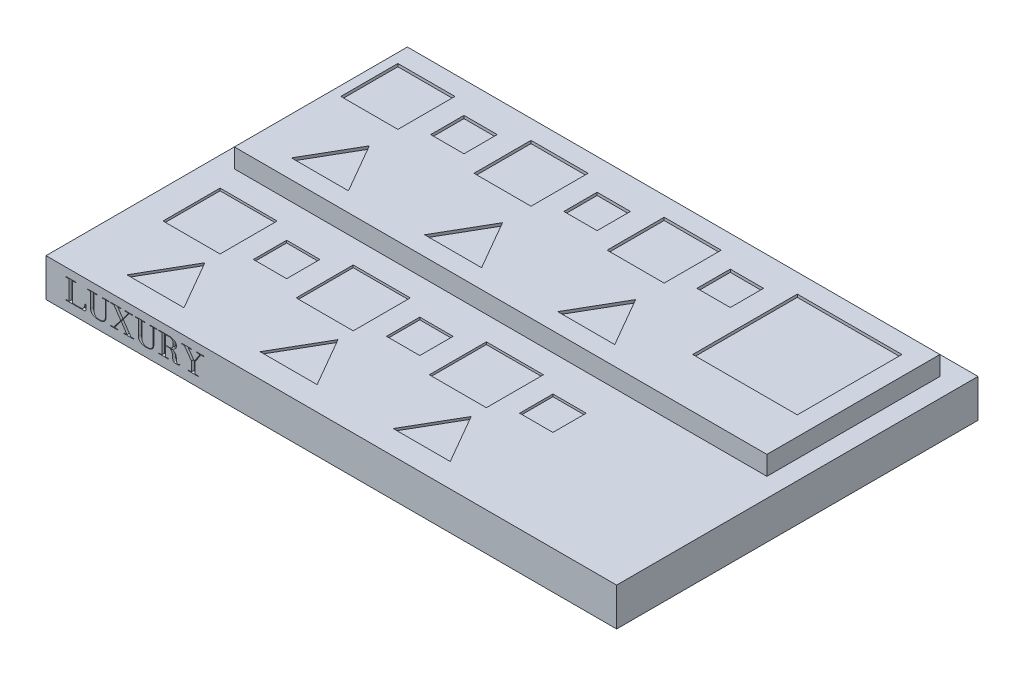
from build123d import *

# Parameters (mm, degrees)
SKETCH1_W           = 600
SKETCH1_H           = 380
BOSS_EXTRUDE3_DEPTH = 40
CUT_EXTRUDE1_DEPTH  = 3
SKETCH5_R           = 25
SKETCH5_W           = 60
SKETCH5_H           = 60
CUT_EXTRUDE2_DEPTH  = 3
SKETCH6_W           = 560
SKETCH6_H           = 181.961524227
BOSS_EXTRUDE4_DEPTH = 20
SKETCH8_W           = 60
SKETCH8_H           = 60
SKETCH8_W_2         = 35
SKETCH8_H_2         = 35
SKETCH8_W_3         = 110
SKETCH8_H_3         = 110
CUT_EXTRUDE12_DEPTH = 3
SKETCH8_7_W         = 60
SKETCH8_7_H         = 60
SKETCH8_7_W_2       = 35
SKETCH8_7_H_2       = 35
CUT_EXTRUDE13_DEPTH = 22.5


with BuildPart() as part:
    # Sketch1 → Boss-Extrude3 (new body)
    with BuildSketch(Plane(origin=(0, 0, 0), x_dir=(1, 0, 0), z_dir=(0, 1, 0))):
        Rectangle(SKETCH1_W, SKETCH1_H)
    extrude(amount=-BOSS_EXTRUDE3_DEPTH)

    # Sketch2 → Cut-Extrude1 (cut)
    # profile 1 of 6: a face of its own
    with BuildSketch(Plane.XY.offset(190)):
        with BuildLine():
            add(Edge.make_bspline(
                [(-258.895558648, -23.936742187), (-258.997269322, -24.328875191), (-259.191725751, -25.078578054), (-259.466634354, -25.9856335), (-259.720538833, -26.645863024), (-259.929426881, -27.099135568), (-260.174917938, -27.515424324), (-260.443382228, -27.901972822), (-260.751834109, -28.246508697), (-261.09308975, -28.555337155), (-261.480890253, -28.810047091), (-261.903130637, -29.031704786), (-262.375316644, -29.200067568), (-262.902279881, -29.313090604), (-263.482805759, -29.39096417), (-263.890288122, -29.397666543), (-264.102662001, -29.401159722)],
                knots=[0, 0, 0, 0, 2.029248764, 3.879636745, 4.742725827, 5.570893073, 6.376049095, 7.160594553, 7.924093065, 8.687591576, 9.458842347, 10.241402153, 11.071592956, 11.960350658, 12.936964441, 14, 14, 14, 14], degree=3))
            Line((-264.102662001, -29.401159722), (-271.901620931, -29.401159722))
            Line((-271.901620931, -29.401159722), (-271.901620931, -9.040590278))
            Line((-271.901620931, -9.040590278), (-268.289865506, -9.040590278))
            Line((-268.289865506, -9.040590278), (-268.289865506, -8.44175))
            Line((-268.289865506, -8.44175), (-278.85846072, -8.44175))
            Line((-278.85846072, -8.44175), (-278.85846072, -9.040590278))
            Line((-278.85846072, -9.040590278), (-275.588231391, -9.040590278))
            Line((-275.588231391, -9.040590278), (-275.588231391, -29.401159722))
            Line((-275.588231391, -29.401159722), (-278.85846072, -29.401159722))
            Line((-278.85846072, -29.401159722), (-278.85846072, -30))
            Line((-278.85846072, -30), (-259.274512261, -30))
            add(Edge.make_bspline(
                [(-259.274512261, -30), (-259.188418744, -29.996502143), (-259.025444389, -29.989880726), (-258.798907857, -29.938643412), (-258.601632119, -29.855451762), (-258.447477975, -29.724175967), (-258.318622939, -29.566398032), (-258.237314891, -29.368031161), (-258.184675279, -29.138805425), (-258.178414328, -28.974213972), (-258.175078939, -28.886531359)],
                knots=[0, 0, 0, 0, 1.151657564, 2.180078777, 3.096125633, 3.986580873, 4.863960426, 5.799091186, 6.827512399, 8, 8, 8, 8], degree=3))
            Line((-258.175078939, -28.886531359), (-258.175078939, -24.034989421))
            add(Edge.make_bspline(
                [(-258.175078939, -24.034989421), (-258.177842651, -23.920401065), (-258.182623748, -23.722168357), (-258.229247011, -23.47393322), (-258.325636232, -23.292791061), (-258.432069631, -23.268929615), (-258.479177517, -23.258368435)],
                knots=[0, 0, 0, 0, 1.51012458, 2.612447694, 3.385863296, 4, 4, 4, 4], degree=3))
            add(Edge.make_bspline(
                [(-258.479177517, -23.258368435), (-258.523973094, -23.26803895), (-258.624594211, -23.28976114), (-258.731891004, -23.446992928), (-258.825800689, -23.660647313), (-258.870391303, -23.837132407), (-258.895558648, -23.936742187)],
                knots=[0, 0, 0, 0, 0.632397312, 1.420509106, 2.544112054, 4, 4, 4, 4], degree=3))
        make_face()
    # profile 2 of 6: a face of its own
    with BuildSketch(Plane.XY.offset(190)):
        with BuildLine():
            Line((-246.179559625, -8.44175), (-256.406628743, -8.44175))
            Line((-256.406628743, -8.44175), (-256.406628743, -9.040590278))
            Line((-256.406628743, -9.040590278), (-253.136399414, -9.040590278))
            Line((-253.136399414, -9.040590278), (-253.136399414, -24.853716363))
            add(Edge.make_bspline(
                [(-253.136399414, -24.853716363), (-253.129091047, -25.127464043), (-253.114938624, -25.657567788), (-252.958944178, -26.414012673), (-252.724115678, -27.107572296), (-252.376163673, -27.72398883), (-251.948943331, -28.269132845), (-251.474815745, -28.768124964), (-250.935649017, -29.203146874), (-250.346164703, -29.587332901), (-249.708489747, -29.911400279), (-249.036208214, -30.189605845), (-248.327052165, -30.414199964), (-247.587754635, -30.583579351), (-246.832406052, -30.707637561), (-246.076557359, -30.794545846), (-245.325933191, -30.854918852), (-244.827605857, -30.861990832), (-244.579533257, -30.865511339)],
                knots=[0, 0, 0, 0, 1.117332706, 2.163679528, 3.143466512, 4.099407962, 5.040333412, 5.969023148, 6.90683423, 7.865110614, 8.840116802, 9.826187186, 10.836176266, 11.876779503, 12.923669842, 13.963394149, 14.986156138, 16, 16, 16, 16], degree=3))
            add(Edge.make_bspline(
                [(-244.579533257, -30.865511339), (-244.286204943, -30.86127932), (-243.715819197, -30.853050033), (-242.886020591, -30.782033346), (-242.105950809, -30.6661183), (-241.376490544, -30.504556763), (-240.695059396, -30.293231248), (-240.065763069, -30.032630555), (-239.484028494, -29.726540631), (-238.953680878, -29.37655212), (-238.47592973, -28.978014296), (-238.063995768, -28.526866401), (-237.711135186, -28.03053949), (-237.43257444, -27.483314439), (-237.209864747, -26.892060914), (-237.052638716, -26.25466638), (-236.957991457, -25.569230774), (-236.945888478, -25.097308668), (-236.939641276, -24.853716363)],
                knots=[0, 0, 0, 0, 1.273533264, 2.476423814, 3.613205589, 4.695854947, 5.717487145, 6.707201097, 7.649273476, 8.567684301, 9.461602455, 10.343487192, 11.213356554, 12.09773367, 13.00205606, 13.951353435, 14.942548926, 16, 16, 16, 16], degree=3))
            Line((-236.939641276, -24.853716363), (-236.939641276, -9.040590278))
            Line((-236.939641276, -9.040590278), (-233.669411947, -9.040590278))
            Line((-233.669411947, -9.040590278), (-233.669411947, -8.44175))
            Line((-233.669411947, -8.44175), (-240.818067763, -8.44175))
            Line((-240.818067763, -8.44175), (-240.818067763, -9.040590278))
            Line((-240.818067763, -9.040590278), (-237.547838433, -9.040590278))
            Line((-237.547838433, -9.040590278), (-237.547838433, -24.853716363))
            add(Edge.make_bspline(
                [(-237.547838433, -24.853716363), (-237.55260588, -25.063025506), (-237.56193744, -25.472716696), (-237.653384597, -26.070468151), (-237.801594332, -26.636272823), (-238.014995859, -27.16422664), (-238.27113127, -27.65795862), (-238.576931246, -28.110490803), (-238.931676118, -28.5202205), (-239.32793145, -28.889910044), (-239.768686468, -29.212852709), (-240.240601997, -29.501694813), (-240.754972662, -29.736694882), (-241.29617451, -29.940588118), (-241.867478876, -30.091376299), (-242.459533566, -30.205850096), (-243.074733858, -30.271087827), (-243.492428818, -30.280567881), (-243.704665039, -30.28538482)],
                knots=[0, 0, 0, 0, 1.08716204, 2.127956295, 3.13454735, 4.120366762, 5.081077667, 6.020736822, 6.951722068, 7.89225469, 8.830829615, 9.787154316, 10.76252305, 11.765223536, 12.789572198, 13.829166544, 14.896971397, 16, 16, 16, 16], degree=3))
            add(Edge.make_bspline(
                [(-243.704665039, -30.28538482), (-243.921616383, -30.280836566), (-244.344064065, -30.271980206), (-244.958637606, -30.204998245), (-245.538599215, -30.099886928), (-246.082722005, -29.943542197), (-246.595668615, -29.749739912), (-247.070561413, -29.503060407), (-247.512306409, -29.218153132), (-247.916569085, -28.889763553), (-248.279205688, -28.518937858), (-248.592645576, -28.106706744), (-248.857207567, -27.654967942), (-249.076874757, -27.169476723), (-249.247685368, -26.64403873), (-249.359289103, -26.079986375), (-249.439112527, -25.479764546), (-249.4461672, -25.066090108), (-249.449788954, -24.853716363)],
                knots=[0, 0, 0, 0, 1.159318662, 2.257425426, 3.300403983, 4.305630874, 5.279261004, 6.226122027, 7.160129137, 8.084378505, 9.003880179, 9.925758757, 10.844920372, 11.796173507, 12.768804163, 13.790483183, 14.865669914, 16, 16, 16, 16], degree=3))
            Line((-249.449788954, -24.853716363), (-249.449788954, -9.040590278))
            Line((-249.449788954, -9.040590278), (-246.179559625, -9.040590278))
            Line((-246.179559625, -9.040590278), (-246.179559625, -8.44175))
        make_face()
    # profile 3 of 6: a face of its own
    with BuildSketch(Plane.XY.offset(190)):
        Polygon((-221.014232639, -9.040590278), (-221.014232639, -8.44175), (-231.92435395, -8.44175), (-231.92435395, -9.040590278), (-228.65412462, -9.040590278), (-221.43061377, -19.665326769), (-228.696230577, -29.401159722), (-232.003887424, -29.401159722), (-232.003887424, -30), (-224.055218424, -30), (-224.055218424, -29.401159722), (-227.858789876, -29.401159722), (-221.014232639, -20.123813856), (-214.815300076, -29.401159722), (-217.893713379, -29.401159722), (-217.893713379, -30), (-207.704071777, -30), (-207.704071777, -29.401159722), (-210.632775011, -29.401159722), (-218.73115408, -17.471138563), (-212.494794, -9.040590278), (-209.070176161, -9.040590278), (-209.070176161, -8.44175), (-217.056272678, -8.44175), (-217.056272678, -9.040590278), (-213.369662218, -9.040590278), (-219.147535211, -16.993937717), (-224.471599555, -9.040590278), align=None)
    # profile 4 of 6: a face of its own
    with BuildSketch(Plane.XY.offset(190)):
        with BuildLine():
            Line((-195.876976291, -8.44175), (-206.10404541, -8.44175))
            Line((-206.10404541, -8.44175), (-206.10404541, -9.040590278))
            Line((-206.10404541, -9.040590278), (-202.833816081, -9.040590278))
            Line((-202.833816081, -9.040590278), (-202.833816081, -24.853716363))
            add(Edge.make_bspline(
                [(-202.833816081, -24.853716363), (-202.826507713, -25.127464043), (-202.812355291, -25.657567788), (-202.656360845, -26.414012673), (-202.421532345, -27.107572296), (-202.07358034, -27.72398883), (-201.646359998, -28.269132845), (-201.172232411, -28.768124964), (-200.633065683, -29.203146874), (-200.04358137, -29.587332901), (-199.405906413, -29.911400279), (-198.733624881, -30.189605845), (-198.024468832, -30.414199964), (-197.285171302, -30.583579351), (-196.529822719, -30.707637561), (-195.773974025, -30.794545846), (-195.023349857, -30.854918852), (-194.525022524, -30.861990832), (-194.276949924, -30.865511339)],
                knots=[0, 0, 0, 0, 1.117332706, 2.163679528, 3.143466512, 4.099407962, 5.040333412, 5.969023148, 6.90683423, 7.865110614, 8.840116802, 9.826187186, 10.836176266, 11.876779503, 12.923669842, 13.963394149, 14.986156138, 16, 16, 16, 16], degree=3))
            add(Edge.make_bspline(
                [(-194.276949924, -30.865511339), (-193.98362161, -30.86127932), (-193.413235863, -30.853050033), (-192.583437257, -30.782033346), (-191.803367475, -30.6661183), (-191.073907211, -30.504556763), (-190.392476063, -30.293231248), (-189.763179736, -30.032630555), (-189.181445161, -29.726540631), (-188.651097544, -29.37655212), (-188.173346397, -28.978014296), (-187.761412434, -28.526866401), (-187.408551853, -28.03053949), (-187.129991106, -27.483314439), (-186.907281413, -26.892060914), (-186.750055383, -26.25466638), (-186.655408124, -25.569230774), (-186.643305144, -25.097308668), (-186.637057943, -24.853716363)],
                knots=[0, 0, 0, 0, 1.273533264, 2.476423814, 3.613205589, 4.695854947, 5.717487145, 6.707201097, 7.649273476, 8.567684301, 9.461602455, 10.343487192, 11.213356554, 12.09773367, 13.00205606, 13.951353435, 14.942548926, 16, 16, 16, 16], degree=3))
            Line((-186.637057943, -24.853716363), (-186.637057943, -9.040590278))
            Line((-186.637057943, -9.040590278), (-183.366828613, -9.040590278))
            Line((-183.366828613, -9.040590278), (-183.366828613, -8.44175))
            Line((-183.366828613, -8.44175), (-190.515484429, -8.44175))
            Line((-190.515484429, -8.44175), (-190.515484429, -9.040590278))
            Line((-190.515484429, -9.040590278), (-187.2452551, -9.040590278))
            Line((-187.2452551, -9.040590278), (-187.2452551, -24.853716363))
            add(Edge.make_bspline(
                [(-187.2452551, -24.853716363), (-187.250022546, -25.063025506), (-187.259354106, -25.472716696), (-187.350801264, -26.070468151), (-187.499010999, -26.636272823), (-187.712412526, -27.16422664), (-187.968547937, -27.65795862), (-188.274347913, -28.110490803), (-188.629092785, -28.5202205), (-189.025348116, -28.889910044), (-189.466103135, -29.212852709), (-189.938018664, -29.501694813), (-190.452389329, -29.736694882), (-190.993591176, -29.940588118), (-191.564895543, -30.091376299), (-192.156950232, -30.205850096), (-192.772150525, -30.271087827), (-193.189845485, -30.280567881), (-193.402081706, -30.28538482)],
                knots=[0, 0, 0, 0, 1.08716204, 2.127956295, 3.13454735, 4.120366762, 5.081077667, 6.020736822, 6.951722068, 7.89225469, 8.830829615, 9.787154316, 10.76252305, 11.765223536, 12.789572198, 13.829166544, 14.896971397, 16, 16, 16, 16], degree=3))
            add(Edge.make_bspline(
                [(-193.402081706, -30.28538482), (-193.61903305, -30.280836566), (-194.041480732, -30.271980206), (-194.656054273, -30.204998245), (-195.236015881, -30.099886928), (-195.780138672, -29.943542197), (-196.293085282, -29.749739912), (-196.76797808, -29.503060407), (-197.209723076, -29.218153132), (-197.613985751, -28.889763553), (-197.976622355, -28.518937858), (-198.290062242, -28.106706744), (-198.554624234, -27.654967942), (-198.774291424, -27.169476723), (-198.945102035, -26.64403873), (-199.05670577, -26.079986375), (-199.136529194, -25.479764546), (-199.143583866, -25.066090108), (-199.147205621, -24.853716363)],
                knots=[0, 0, 0, 0, 1.159318662, 2.257425426, 3.300403983, 4.305630874, 5.279261004, 6.226122027, 7.160129137, 8.084378505, 9.003880179, 9.925758757, 10.844920372, 11.796173507, 12.768804163, 13.790483183, 14.865669914, 16, 16, 16, 16], degree=3))
            Line((-199.147205621, -24.853716363), (-199.147205621, -9.040590278))
            Line((-199.147205621, -9.040590278), (-195.876976291, -9.040590278))
            Line((-195.876976291, -9.040590278), (-195.876976291, -8.44175))
        make_face()
    # profile 5 of 6: a face of its own
    with BuildSketch(Plane.XY.offset(190)):
        with BuildLine():
            add(Edge.make_bspline(
                [(-162.608591797, -28.601146539), (-162.646287126, -28.472422793), (-162.732284525, -28.178754908), (-162.787105054, -27.674183296), (-162.833778123, -27.087711291), (-162.858245031, -26.442940738), (-162.875665445, -25.767547008), (-162.891488385, -25.078061812), (-162.92191675, -24.395074879), (-162.994310596, -23.948766735), (-163.029651367, -23.730890842)],
                knots=[0, 0, 0, 0, 0.655957393, 1.496488612, 2.477298458, 3.540149833, 4.655906014, 5.78693514, 6.919639961, 8, 8, 8, 8], degree=3))
            add(Edge.make_bspline(
                [(-163.029651367, -23.730890842), (-163.071838114, -23.525894791), (-163.153115994, -23.130945055), (-163.319915401, -22.570007176), (-163.530595792, -22.066781915), (-163.779995461, -21.61702983), (-164.067251218, -21.219330003), (-164.365972671, -20.847039837), (-164.714546004, -20.532284404), (-165.080013048, -20.243215636), (-165.475070443, -19.989625271), (-165.901276138, -19.770448222), (-166.352858679, -19.571491447), (-167.009519404, -19.358235974), (-167.877814558, -19.107239815), (-168.592997663, -18.941467548), (-168.961912869, -18.855956706)],
                knots=[0, 0, 0, 0, 1.058690871, 2.039696259, 2.955615244, 3.813985326, 4.634946734, 5.436102678, 6.223303958, 7.004630519, 7.792582813, 8.593738757, 9.427791834, 10.286161916, 12.084278932, 14, 14, 14, 14], degree=3))
            add(Edge.make_bspline(
                [(-168.961912869, -18.855956706), (-168.721239889, -18.816501543), (-168.251656276, -18.7395195), (-167.574740787, -18.582953894), (-166.937217996, -18.407808927), (-166.346298002, -18.196206421), (-165.793261406, -17.964650672), (-165.28880502, -17.695691796), (-164.822074433, -17.406641087), (-164.400643584, -17.088794004), (-164.024786139, -16.745932282), (-163.693111047, -16.3830527), (-163.423724493, -15.988306373), (-163.187774301, -15.582609018), (-163.017679031, -15.147327775), (-162.888686502, -14.695170146), (-162.812299024, -14.219099708), (-162.804420186, -13.893964558), (-162.800407823, -13.728386827)],
                knots=[0, 0, 0, 0, 1.330288061, 2.595561308, 3.7888398, 4.935241544, 6.017823251, 7.05686544, 8.05075343, 9.010513114, 9.93198304, 10.823708024, 11.685249424, 12.534817631, 13.378528594, 14.227030977, 15.097101042, 16, 16, 16, 16], degree=3))
            add(Edge.make_bspline(
                [(-162.800407823, -13.728386827), (-162.806864711, -13.525037342), (-162.81954395, -13.125724726), (-162.941855369, -12.542938407), (-163.136543824, -11.99145394), (-163.418572625, -11.478820434), (-163.762071676, -11.003718631), (-164.15420527, -10.55765809), (-164.614756043, -10.16651284), (-165.122029321, -9.809164787), (-165.679959948, -9.491846364), (-166.288402769, -9.213206548), (-166.949250472, -8.983324347), (-167.653779462, -8.786693099), (-168.393618358, -8.63553583), (-169.158629672, -8.521556011), (-169.946358735, -8.45614372), (-170.479170114, -8.446589758), (-170.749076823, -8.44175)],
                knots=[0, 0, 0, 0, 0.918060549, 1.802773966, 2.678994842, 3.552631952, 4.436755514, 5.325335386, 6.22979267, 7.160644236, 8.126723572, 9.126591794, 10.18109265, 11.285846637, 12.430469083, 13.591789647, 14.780070858, 16, 16, 16, 16], degree=3))
            Line((-170.749076823, -8.44175), (-181.472060547, -8.44175))
            Line((-181.472060547, -8.44175), (-181.472060547, -9.040590278))
            Line((-181.472060547, -9.040590278), (-178.201831217, -9.040590278))
            Line((-178.201831217, -9.040590278), (-178.201831217, -29.382445964))
            Line((-178.201831217, -29.382445964), (-181.472060547, -29.382445964))
            Line((-181.472060547, -29.382445964), (-181.472060547, -29.901752767))
            Line((-181.472060547, -29.901752767), (-171.240312988, -29.901752767))
            Line((-171.240312988, -29.901752767), (-171.240312988, -29.382445964))
            Line((-171.240312988, -29.382445964), (-174.510542318, -29.382445964))
            Line((-174.510542318, -29.382445964), (-174.510542318, -18.986953016))
            Line((-174.510542318, -18.986953016), (-171.35727398, -18.986953016))
            add(Edge.make_bspline(
                [(-171.35727398, -18.986953016), (-171.147789375, -18.995708804), (-170.712547762, -19.013900515), (-170.167873756, -19.123911303), (-169.725507064, -19.261882953), (-169.396141913, -19.407034129), (-169.080895519, -19.59621262), (-168.780036034, -19.827477301), (-168.494770166, -20.100213156), (-168.222076386, -20.415906566), (-167.985373403, -20.789925869), (-167.750619434, -21.203094978), (-167.545616646, -21.672771288), (-167.371874854, -22.203554467), (-167.233603161, -22.795619273), (-167.170224512, -23.214176257), (-167.137321398, -23.431470703)],
                knots=[0, 0, 0, 0, 1.291503604, 2.683328987, 3.410180304, 4.146386267, 4.896775263, 5.671896977, 6.481334619, 7.327251774, 8.236753741, 9.205342658, 10.255955911, 11.390245282, 12.645142171, 14, 14, 14, 14], degree=3))
            add(Edge.make_bspline(
                [(-167.137321398, -23.431470703), (-167.101781509, -23.710257191), (-167.030285677, -24.271093835), (-167.002317601, -25.117367414), (-166.971368964, -25.952703642), (-166.903125776, -26.759244277), (-166.768416006, -27.519684842), (-166.601966486, -28.116529827), (-166.415228314, -28.55684911), (-166.23520137, -28.858215152), (-166.019671213, -29.136398848), (-165.851233507, -29.300121756), (-165.766538574, -29.382445964)],
                knots=[0, 0, 0, 0, 1.346851798, 2.709470786, 4.056799944, 5.355976827, 6.586634075, 7.75556205, 8.318187368, 8.874767342, 9.434203262, 10, 10, 10, 10], degree=3))
            add(Edge.make_bspline(
                [(-165.766538574, -29.382445964), (-165.682978792, -29.455695094), (-165.517143172, -29.601067839), (-165.228965477, -29.764795464), (-164.930692126, -29.911946603), (-164.491305406, -30.037091976), (-163.905632392, -30.133800427), (-163.426206716, -30.150479353), (-163.179361437, -30.159066949)],
                knots=[0, 0, 0, 0, 0.721200461, 1.431319263, 2.148653437, 2.880627143, 4.393906499, 6, 6, 6, 6], degree=3))
            add(Edge.make_bspline(
                [(-163.179361437, -30.159066949), (-162.963877467, -30.153699934), (-162.531289326, -30.142925549), (-161.891953916, -30.055030394), (-161.278684141, -29.926715058), (-160.705120976, -29.787458089), (-160.196665054, -29.620316994), (-159.763722928, -29.446887989), (-159.411390127, -29.288777088), (-159.22912638, -29.15118924), (-159.151224881, -29.092382704)],
                knots=[0, 0, 0, 0, 1.225448475, 2.460110978, 3.664112692, 4.789453046, 5.816270967, 6.704237064, 7.446176891, 8, 8, 8, 8], degree=3))
            add(Edge.make_bspline(
                [(-159.151224881, -29.092382704), (-159.116719516, -29.062382752), (-159.056772653, -29.010263233), (-159.040970385, -28.933250812), (-159.034263889, -28.900566678)],
                knots=[0, 0, 0, 0, 1.151198346, 2, 2, 2, 2], degree=3))
            add(Edge.make_bspline(
                [(-159.034263889, -28.900566678), (-159.039803083, -28.871388958), (-159.051710948, -28.808664247), (-159.116548097, -28.804530365), (-159.151224881, -28.802319444)],
                knots=[0, 0, 0, 0, 0.930342103, 2, 2, 2, 2], degree=3))
            add(Edge.make_bspline(
                [(-159.151224881, -28.802319444), (-159.182768813, -28.807390723), (-159.262851349, -28.820265492), (-159.336082497, -28.855698361), (-159.380468424, -28.877174479)],
                knots=[0, 0, 0, 0, 0.787785546, 2, 2, 2, 2], degree=3))
            add(Edge.make_bspline(
                [(-159.380468424, -28.877174479), (-159.509226076, -28.957856728), (-159.763375303, -29.117111973), (-160.18434677, -29.281365188), (-160.627823491, -29.38318652), (-160.933148952, -29.395109113), (-161.088098904, -29.401159722)],
                knots=[0, 0, 0, 0, 1.003798986, 1.981355941, 2.975556118, 4, 4, 4, 4], degree=3))
            add(Edge.make_bspline(
                [(-161.088098904, -29.401159722), (-161.181817477, -29.398356267), (-161.362240458, -29.392959176), (-161.619353957, -29.355210823), (-161.852147087, -29.297192965), (-162.055883736, -29.205664741), (-162.235968578, -29.094482456), (-162.389244372, -28.954828939), (-162.517706261, -28.790863884), (-162.578077473, -28.664843105), (-162.608591797, -28.601146539)],
                knots=[0, 0, 0, 0, 1.22956044, 2.367097082, 3.404680452, 4.366852149, 5.286734159, 6.170619353, 7.075348788, 8, 8, 8, 8], degree=3))
        make_face()
        with BuildLine():
            Line((-174.510542318, -18.645426921), (-174.510542318, -9.040590278))
            Line((-174.510542318, -9.040590278), (-170.749076823, -9.040590278))
            add(Edge.make_bspline(
                [(-170.749076823, -9.040590278), (-170.574334649, -9.044871153), (-170.235135262, -9.05318094), (-169.741903363, -9.097551814), (-169.281864842, -9.182075638), (-168.856557751, -9.299049005), (-168.462339856, -9.442249619), (-168.105707411, -9.626895586), (-167.780087262, -9.840799033), (-167.492581281, -10.094094166), (-167.231498623, -10.374051398), (-167.012758626, -10.694195005), (-166.830233287, -11.045886389), (-166.672979677, -11.424987066), (-166.559836141, -11.842282602), (-166.467673937, -12.288527298), (-166.425011118, -12.771619443), (-166.416546537, -13.102984504), (-166.412163249, -13.274578179)],
                knots=[0, 0, 0, 0, 1.206373509, 2.341742378, 3.414293141, 4.430140177, 5.383862176, 6.303377869, 7.196038711, 8.065887099, 8.94204002, 9.831840596, 10.732255986, 11.673750274, 12.65849521, 13.711915589, 14.815141183, 16, 16, 16, 16], degree=3))
            Line((-166.412163249, -13.274578179), (-166.412163249, -14.439509657))
            add(Edge.make_bspline(
                [(-166.412163249, -14.439509657), (-166.416609914, -14.609539183), (-166.425234817, -14.939334197), (-166.467284457, -15.419392665), (-166.559695094, -15.862543094), (-166.673818002, -16.276390709), (-166.830330224, -16.654082358), (-167.011570423, -17.005091932), (-167.231572147, -17.321599512), (-167.494009972, -17.596861468), (-167.780132304, -17.849604089), (-168.104321144, -18.065164826), (-168.464841119, -18.241063827), (-168.854433063, -18.394849604), (-169.282955077, -18.501741343), (-169.741702745, -18.589125573), (-170.235190354, -18.632654962), (-170.57435338, -18.641084404), (-170.749076823, -18.645426921)],
                knots=[0, 0, 0, 0, 1.177948131, 2.284787998, 3.331067487, 4.308654484, 5.253233198, 6.156598434, 7.040451368, 7.911544253, 8.784242347, 9.679827631, 10.597475447, 11.558153833, 12.574521309, 13.650585851, 14.789674297, 16, 16, 16, 16], degree=3))
            Line((-170.749076823, -18.645426921), (-174.510542318, -18.645426921))
        make_face(mode=Mode.SUBTRACT)
    # profile 6 of 6: a face of its own
    with BuildSketch(Plane.XY.offset(190)):
        Polygon((-146.907748264, -8.44175), (-157.518449436, -8.44175), (-157.518449436, -9.040590278), (-154.47746365, -9.040590278), (-147.09956429, -19.412691026), (-147.09956429, -29.401159722), (-150.748747233, -29.401159722), (-150.748747233, -30), (-139.759092448, -30), (-139.759092448, -29.401159722), (-143.408275391, -29.401159722), (-143.408275391, -18.584607205), (-137.134487793, -9.040590278), (-134.05607449, -9.040590278), (-134.05607449, -8.44175), (-141.812927463, -8.44175), (-141.812927463, -9.040590278), (-138.126317003, -9.040590278), (-144.016472548, -18.158869195), (-150.407221137, -9.040590278), (-146.907748264, -9.040590278), align=None)
    extrude(amount=-CUT_EXTRUDE1_DEPTH, mode=Mode.SUBTRACT)

    # Sketch5 → Cut-Extrude2 (cut)
    with BuildSketch(Plane(origin=(0, 0, 0), x_dir=(1, 0, 0), z_dir=(0, 1, 0))):
        with Locations(Location((-175, 130, 0), (0, 0, 270))):
            Circle(SKETCH5_R)
        with Locations((-240, 120)):
            Rectangle(SKETCH5_W, SKETCH5_H)
        Polygon((-210, 60), (-240, 8.038475773), (-180, 8.038475773), align=None)
    extrude(amount=-CUT_EXTRUDE2_DEPTH, mode=Mode.SUBTRACT)

    # Sketch6 → Boss-Extrude4 (add)
    with BuildSketch(Plane(origin=(0, 0, 0), x_dir=(1, 0, 0), z_dir=(0, 1, 0))):
        with Locations((0, 79.019237886)):
            Rectangle(SKETCH6_W, SKETCH6_H)
    extrude(amount=BOSS_EXTRUDE4_DEPTH)

    # Sketch8 → Cut-Extrude12 (cut)
    with BuildSketch(Plane(origin=(0, 20, 0), x_dir=(1, 0, 0), z_dir=(0, 1, 0))):
        with Locations((-240, 120)):
            Rectangle(SKETCH8_W, SKETCH8_H)
        with Locations((-170.5, 120)):
            Rectangle(SKETCH8_W_2, SKETCH8_H_2)
        Polygon((100, 8.038475773), (70, 60), (40, 8.038475773), align=None)
        with Locations((205, 95)):
            Rectangle(SKETCH8_W_3, SKETCH8_H_3)
        with Locations((109.5, 120)):
            Rectangle(SKETCH8_W_2, SKETCH8_H_2)
        with Locations((40, 120)):
            Rectangle(SKETCH8_W, SKETCH8_H)
        with Locations((-30.5, 120)):
            Rectangle(SKETCH8_W_2, SKETCH8_H_2)
        Polygon((-210, 60), (-240, 8.038475773), (-180, 8.038475773), align=None)
        Polygon((-70, 60), (-100, 8.038475773), (-40, 8.038475773), align=None)
        with Locations((-100, 120)):
            Rectangle(SKETCH8_W, SKETCH8_H)
    extrude(amount=-CUT_EXTRUDE12_DEPTH, mode=Mode.SUBTRACT)

    # Sketch8<7> → Cut-Extrude13 (cut)
    with BuildSketch(Plane(origin=(0, 20, 0), x_dir=(1, 0, 0), z_dir=(0, 1, 0))):
        with Locations((-240, -66.961524227)):
            Rectangle(SKETCH8_7_W, SKETCH8_7_H)
        with Locations((-170, -66.961524227)):
            Rectangle(SKETCH8_7_W_2, SKETCH8_7_H_2)
        with Locations((-100, -66.961524227)):
            Rectangle(SKETCH8_7_W, SKETCH8_7_H)
        with Locations((-30, -66.961524227)):
            Rectangle(SKETCH8_7_W_2, SKETCH8_7_H_2)
        with Locations((40, -66.961524227)):
            Rectangle(SKETCH8_7_W, SKETCH8_7_H)
        with Locations((110, -66.961524227)):
            Rectangle(SKETCH8_7_W_2, SKETCH8_7_H_2)
        Polygon((100, -164.923048454), (70, -112.961524227), (40, -164.923048454), align=None)
        Polygon((-40, -164.923048454), (-70, -112.961524227), (-100, -164.923048454), align=None)
        Polygon((-180, -164.923048454), (-210, -112.961524227), (-240, -164.923048454), align=None)
    extrude(amount=-CUT_EXTRUDE13_DEPTH, mode=Mode.SUBTRACT)


solid = part.part
